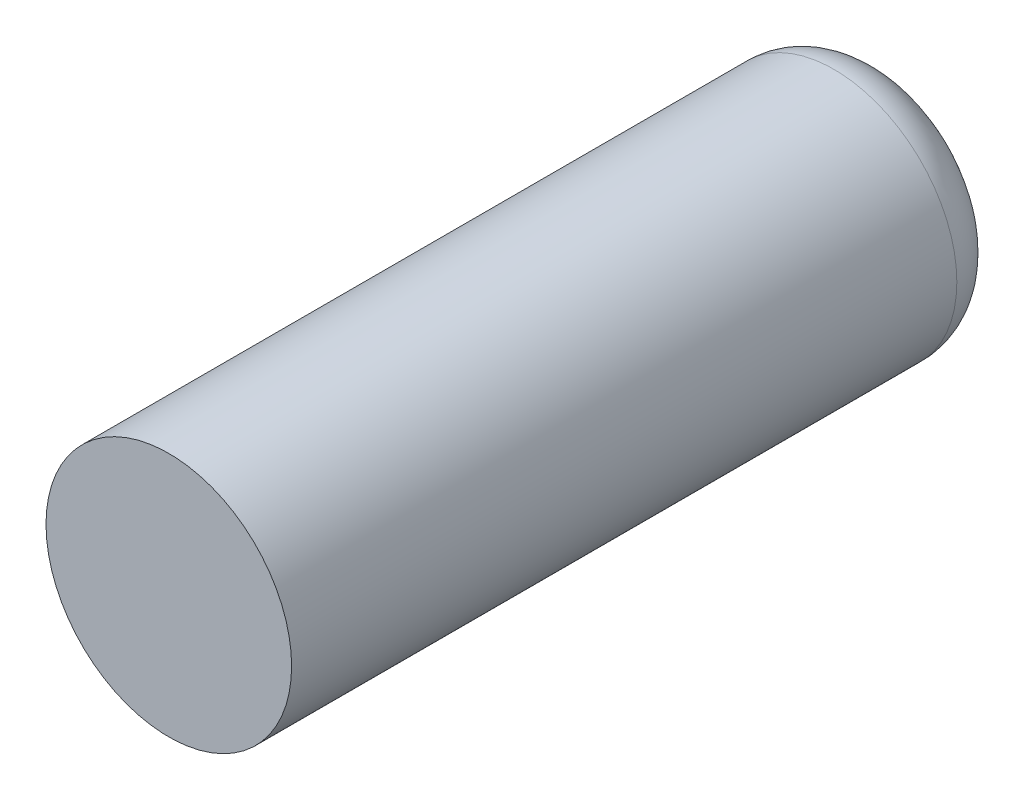
from build123d import *

# Parameters (mm, degrees)
SKETCH_1_R      = 2.4
EXTRUDE_1_DEPTH = 14
FILLET_1_R      = 1


with BuildPart() as part:
    # 草图1 → 凸台-拉伸1 (new body)
    with BuildSketch(Plane.XY):
        Circle(SKETCH_1_R)
    extrude(amount=EXTRUDE_1_DEPTH)

    # 圆角1
    fillet_1_edges = [part.edges().sort_by_distance(p)[0] for p in [
        (-2.4, 0, 0),
    ]]
    fillet(fillet_1_edges, radius=FILLET_1_R)


solid = part.part
